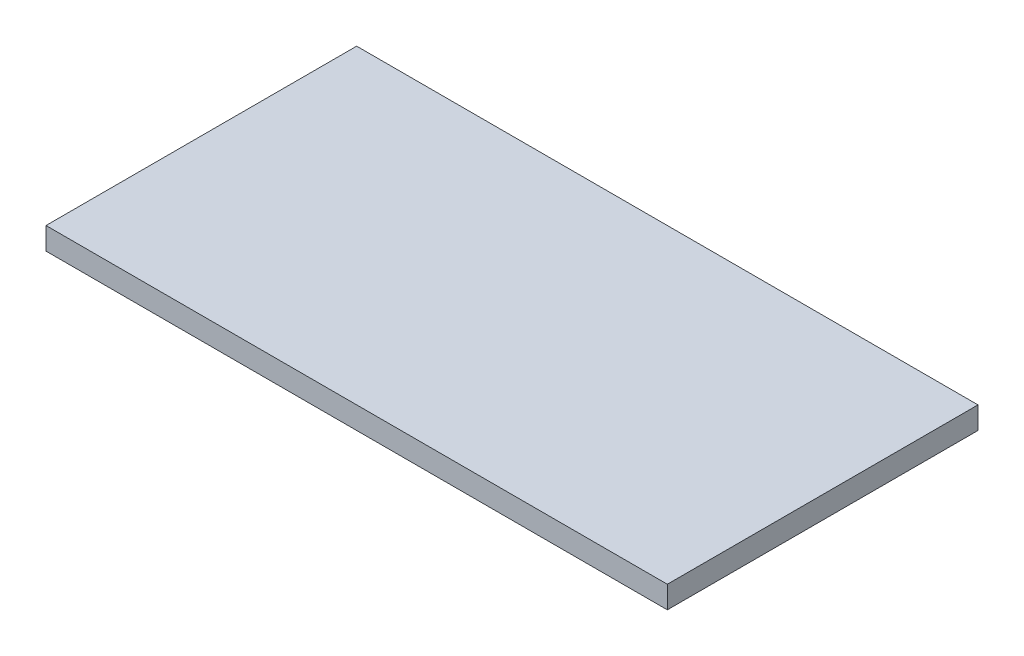
from build123d import *

# Parameters (mm, degrees)
SKETCH1_W           = 56
SKETCH1_H           = 28
BOSS_EXTRUDE1_DEPTH = 2


with BuildPart() as part:
    # Sketch1 → Boss-Extrude1 (new body)
    with BuildSketch(Plane(origin=(0, 0, 0), x_dir=(1, 0, 0), z_dir=(0, 1, 0))):
        with Locations((28, 14)):
            Rectangle(SKETCH1_W, SKETCH1_H)
    extrude(amount=BOSS_EXTRUDE1_DEPTH)


solid = part.part
